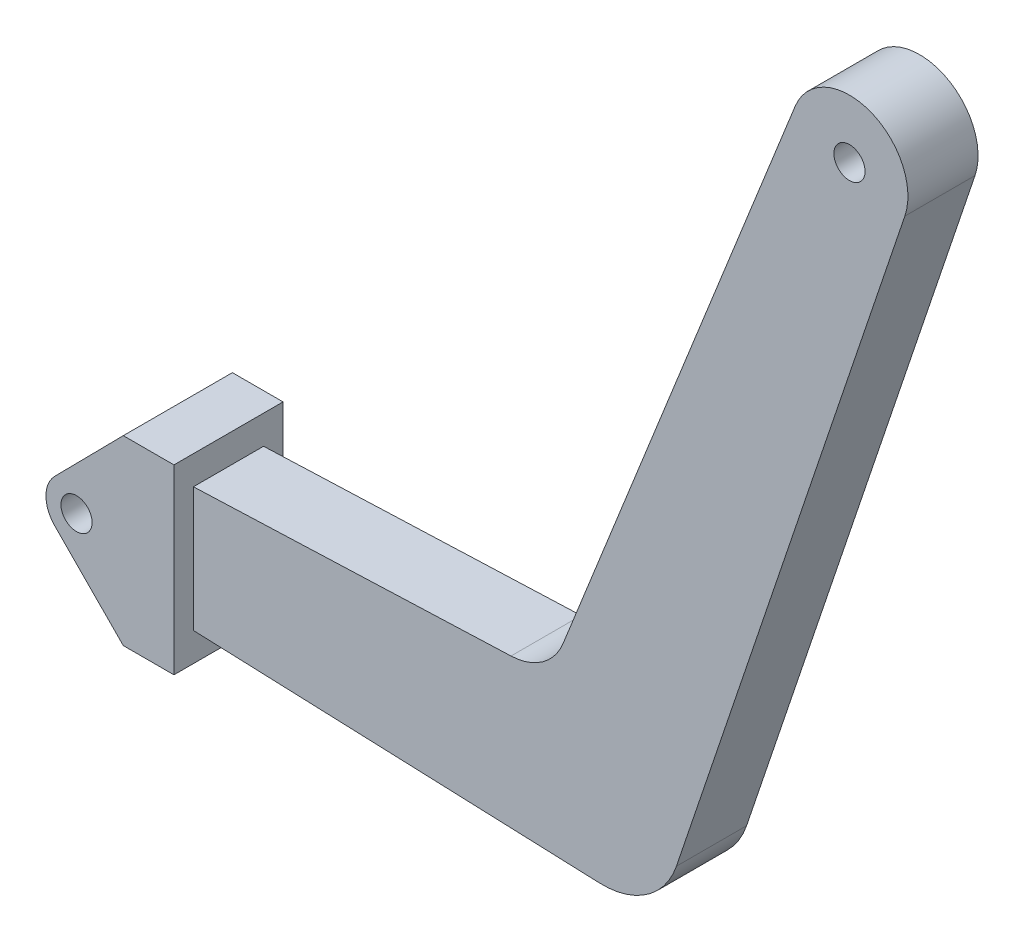
from build123d import *

# Parameters (mm, degrees)
EXTRUDE_1_DEPTH      = 18
SKETCH_10_W          = 36.784417634
SKETCH_10_H          = 49.551694486
CUT_EXTRUDE_7_DEPTH  = 25
SKETCH_11_W          = 28
SKETCH_11_H          = 46.666666667
EXTRUDE_2_DEPTH      = 35
SKETCH_2_R           = 4
CUT_EXTRUDE_9_DEPTH  = 40
CUT_EXTRUDE_10_DEPTH = 22
CUT_EXTRUDE_11_DEPTH = 28


with BuildPart() as part:
    # 草图1 → 凸台-拉伸1 (new body)
    with BuildSketch(Plane.XY):
        with BuildLine():
            Line((-130.576922015, 14.988928879), (-23.496301019, 19.11044112))
            ThreePointArc((-23.496301019, 19.11044112), (-15.422230188, 21.845348847), (-10.142250191, 28.538042722))
            Line((-10.142250191, 28.538042722), (49.433348919, 177.774006572))
            ThreePointArc((49.433348919, 177.774006572), (68.544423032, 186.290222442), (77.578179631, 167.418276909))
            Line((77.578179631, 167.418276909), (18.950963208, -6.392260437))
            ThreePointArc((18.950963208, -6.392260437), (11.349883724, -16.46754807), (-0.770941638, -19.985135701))
            Line((-0.770941638, -19.985135701), (-130.000001063, -15.000027558))
            ThreePointArc((-130.000001063, -15.000027558), (-144.997253695, -0.28851385), (-130.576922015, 14.988928879))
        make_face()
    extrude(amount=EXTRUDE_1_DEPTH)

    # 草图10 → 切除-拉伸7 (cut, symmetric)
    with BuildSketch(Plane.ZY.offset(130)):
        Rectangle(SKETCH_10_W, SKETCH_10_H)
    extrude(amount=CUT_EXTRUDE_7_DEPTH, both=True, mode=Mode.SUBTRACT)

    # 草图11 → 凸台-拉伸2 (add)
    with BuildSketch(Plane.ZY.offset(105)):
        with Locations((9, 0.004479114)):
            Rectangle(SKETCH_11_W, SKETCH_11_H)
    extrude(amount=EXTRUDE_2_DEPTH)

    # 草图2 → 切除-拉伸9 (cut, symmetric)
    with BuildSketch(Plane.XY):
        with Locations((63.364635235, 172.212580846)):
            Circle(SKETCH_2_R)
        with Locations(Location((-130, 0, 0), (0, 0, 270))):
            Circle(SKETCH_2_R)
    extrude(amount=CUT_EXTRUDE_9_DEPTH, both=True, mode=Mode.SUBTRACT)

    # 草图16 → 切除-拉伸10 (cut)
    with BuildSketch(Plane.ZY.offset(140)):
        Polygon((1, 0), (1, -23.32885422), (17, -23.32885422), (17, 23.337812447), (1, 23.337812447), align=None)
    extrude(amount=-CUT_EXTRUDE_10_DEPTH, mode=Mode.SUBTRACT)

    # 草图17 → 切除-拉伸11 (cut)
    with BuildSketch(Plane(origin=(0, 0, -5), x_dir=(-1, 0, 0), z_dir=(0, 0, -1))):
        with BuildLine():
            Line((118, 23.337812447), (140, 23.337812447))
            Line((140, 23.337812447), (140, -23.32885422))
            Line((140, -23.32885422), (118, -23.337812447))
            Line((118, -23.337812447), (135.587008924, -5.512235317))
            ThreePointArc((135.587008924, -5.512235317), (137.848528965, 0), (135.587008924, 5.512235317))
            Line((135.587008924, 5.512235317), (118, 23.337812447))
        make_face()
    extrude(amount=-CUT_EXTRUDE_11_DEPTH, mode=Mode.SUBTRACT)


solid = part.part
